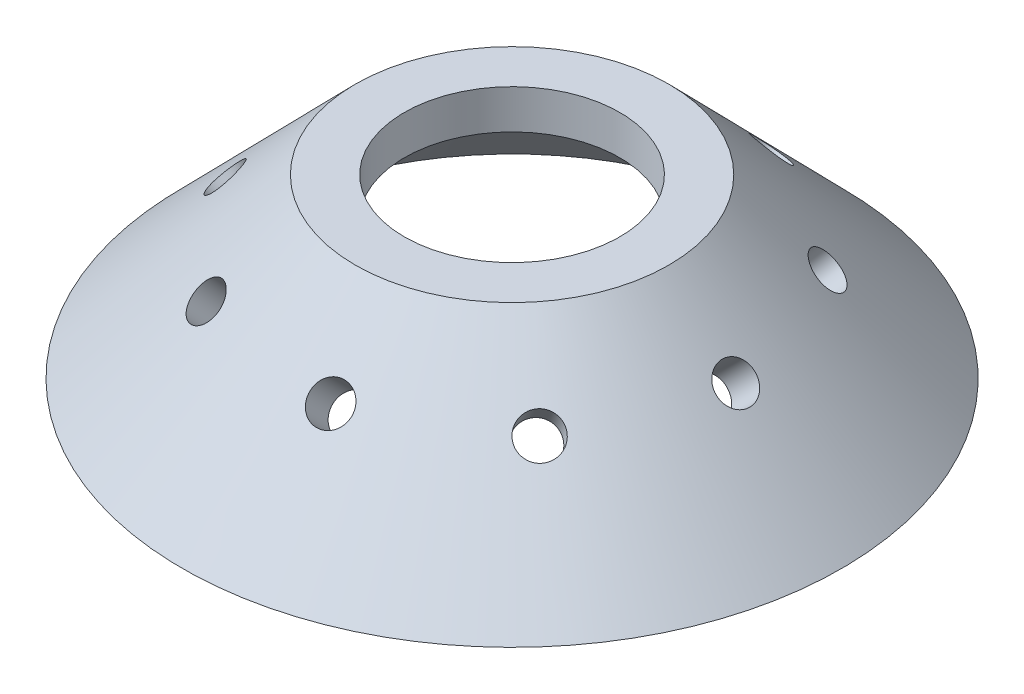
from build123d import *

# Parameters (mm, degrees)
SKETCH11_R         = 13.75
CUT_EXTRUDE1_DEPTH = 64.575802117
SKETCH24_R         = 2.5
CUT_EXTRUDE2_DEPTH = 75.524761464
CIRPATTERN10_COUNT = 9


with BuildPart() as part:
    # Sketch6 → Revolve2 (revolve)
    with BuildSketch(Plane.XY, mode=Mode.PRIVATE) as revolve2_sk:
        Polygon((42.045407685, -22.5), (20, 0), (0, 0), (0, -5), (17.898979486, -5), (35.045407685, -22.5), align=None)
    revolve(revolve2_sk.sketch.rotate(Axis((0, -5, 0), (0, 1, 0)), 90), axis=Axis((0, -5, 0), (0, 1, 0)))

    # Sketch11 → Cut-Extrude1 (cut, through all)
    with BuildSketch(Plane(origin=(0, 0, 0), x_dir=(1, 0, 0), z_dir=(0, 1, 0))):
        with Locations(Location((0, 0, 0), (0, 0, 270))):
            Circle(SKETCH11_R)
    extrude(amount=-CUT_EXTRUDE1_DEPTH, mode=Mode.SUBTRACT)

    # Sketch24 → Cut-Extrude2 (cut, through all)
    with BuildSketch(Plane(origin=(10.204081633, 9.997917317, 0), x_dir=(0, 0, -1), z_dir=(0.714285714285714, 0.6998542122237655, 0))):
        with Locations(Location((0, -26.247084244, 0), (0, 0, 44.709559616))):
            Circle(SKETCH24_R)
    cut_extrude2 = extrude(amount=-CUT_EXTRUDE2_DEPTH, mode=Mode.SUBTRACT)

    # CirPattern10: Cut-Extrude2 ×9 about axis
    cirpattern10_axis = Axis((0, -5, 0), (0, -1, 0))
    for i in range(1, CIRPATTERN10_COUNT):
        add(cut_extrude2.rotate(cirpattern10_axis, i * 360 / CIRPATTERN10_COUNT), mode=Mode.SUBTRACT)


solid = part.part
